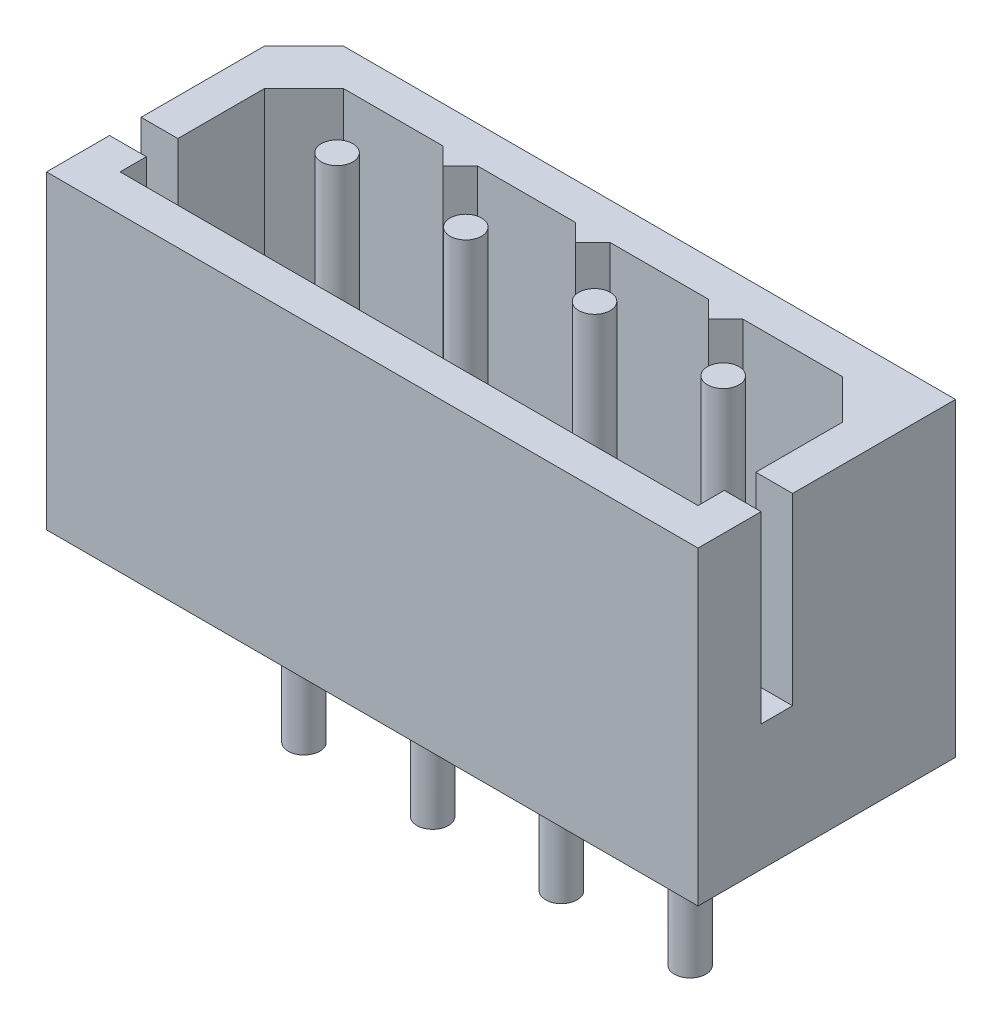
from build123d import *

# Parameters (mm, degrees)
BOSS_EXTRUDE1_DEPTH = 5.9
SKETCH2_R           = 0.3
BOSS_EXTRUDE2_DEPTH = 3.5
SKETCH3_R           = 0.3
CUT_EXTRUDE1_DEPTH  = 3.5


with BuildPart() as part:
    # Sketch1 → Boss-Extrude1 (new body)
    with BuildSketch(Plane(origin=(0, 0, 0), x_dir=(1, 0, 0), z_dir=(0, 1, 0))):
        Polygon((-5.45, 2.45), (-6.2, 1.7), (-6.2, -2.45), (6.2, -2.45), (6.2, 2.45), align=None)
    extrude(amount=-BOSS_EXTRUDE1_DEPTH)

    # Sketch2 → Boss-Extrude2 (add)
    with BuildSketch(Plane.XZ.offset(5.9)):
        with Locations(Location((-3.75, 0, 0), (0, 0, 90))):
            Circle(SKETCH2_R)
        with Locations(Location((-1.3, 0, 0), (0, 0, 90))):
            Circle(SKETCH2_R)
        with Locations(Location((1.15, 0, 0), (0, 0, 90))):
            Circle(SKETCH2_R)
        with Locations(Location((3.6, 0, 0), (0, 0, 90))):
            Circle(SKETCH2_R)
    extrude(amount=BOSS_EXTRUDE2_DEPTH)

    # Sketch3 → Cut-Extrude1 (cut)
    with BuildSketch(Plane(origin=(0, 0, 0), x_dir=(1, 0, 0), z_dir=(0, 1, 0))):
        Polygon((-2.853247496, 1.75), (-4.75, 1.75), (-5.5, 1), (-5.5, -0.65), (-6.2, -0.65), (-6.2, -1.25), (-5.5, -1.25), (-5.5, -1.75), (5.5, -1.75), (5.5, -1.25), (6.2, -1.25), (6.2, -0.65), (5.5, -0.65), (5.5, 1), (4.75, 1.75), (2.853247496, 1.75), (2.525, 1.421752504), (2.196752504, 1.75), (0.328247496, 1.75), (0, 1.421752504), (-0.328247496, 1.75), (-2.196752504, 1.75), (-2.525, 1.421752504), align=None)
        with Locations(Location((-3.75, 0.63, 0), (0, 0, 270))):
            Circle(SKETCH3_R, mode=Mode.SUBTRACT)
        with Locations(Location((-1.3, 0.63, 0), (0, 0, 270))):
            Circle(SKETCH3_R, mode=Mode.SUBTRACT)
        with Locations(Location((1.15, 0.63, 0), (0, 0, 270))):
            Circle(SKETCH3_R, mode=Mode.SUBTRACT)
        with Locations(Location((3.6, 0.63, 0), (0, 0, 270))):
            Circle(SKETCH3_R, mode=Mode.SUBTRACT)
    extrude(amount=-CUT_EXTRUDE1_DEPTH, mode=Mode.SUBTRACT)


solid = part.part
